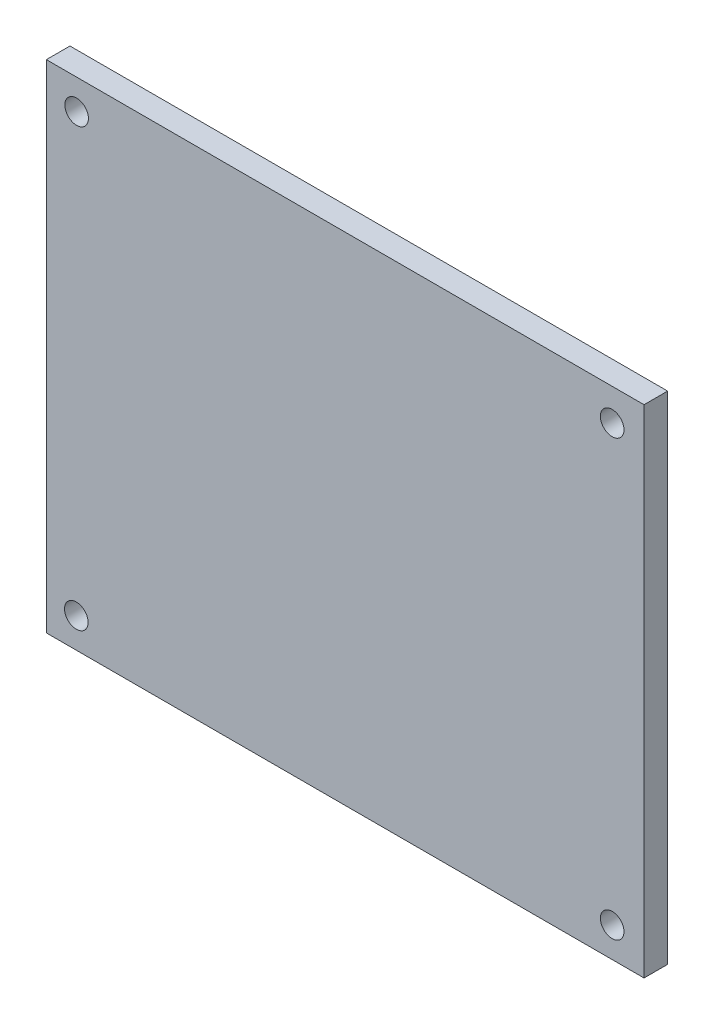
from build123d import *

# Parameters (mm, degrees)
ESQUISSE1_W             = 81.026
ESQUISSE1_H             = 67.31
BOSS_EXTRU_1_DEPTH      = 3.2
ESQUISSE2_R             = 1.6
ENL_V_MAT_EXTRU_1_DEPTH = 3.2


with BuildPart() as part:
    # Esquisse1 → Boss.-Extru.1 (new body)
    with BuildSketch(Plane.XY):
        with Locations((40.513, 33.655)):
            Rectangle(ESQUISSE1_W, ESQUISSE1_H)
    extrude(amount=BOSS_EXTRU_1_DEPTH)

    # Esquisse2 → Enlèv. mat.-Extru.1 (cut)
    with BuildSketch(Plane.XY.offset(3.2)):
        with Locations((4.064, 4.064)):
            Circle(ESQUISSE2_R)
        with Locations((4.1021, 63.246)):
            Circle(ESQUISSE2_R)
        with Locations((76.708, 62.992)):
            Circle(ESQUISSE2_R)
        with Locations((76.708, 4.064)):
            Circle(ESQUISSE2_R)
    extrude(amount=-ENL_V_MAT_EXTRU_1_DEPTH, mode=Mode.SUBTRACT)


solid = part.part
